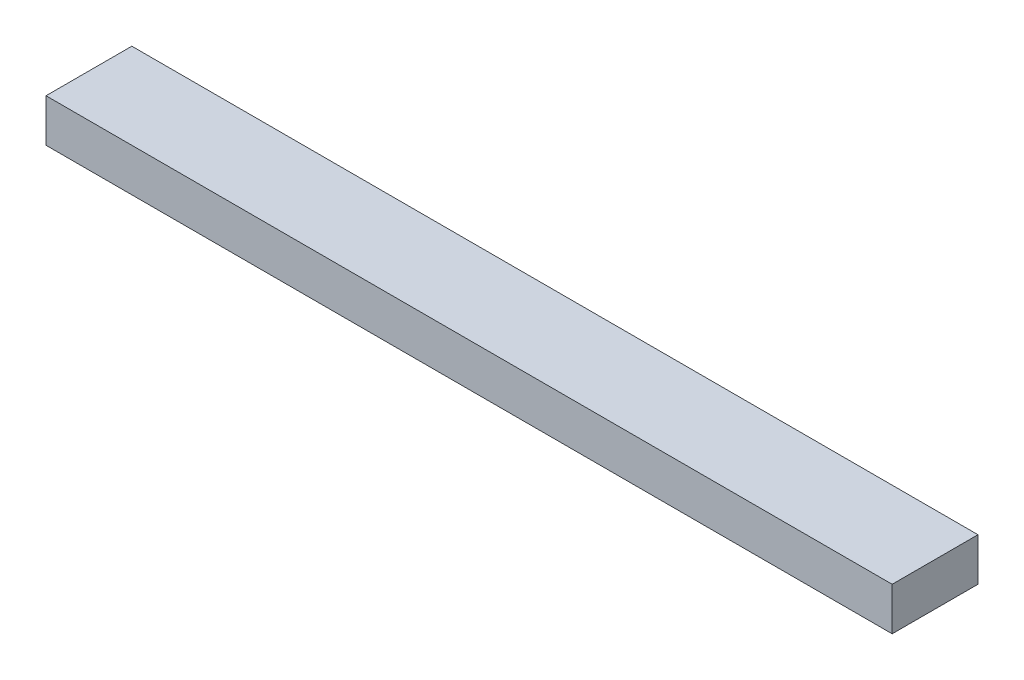
from build123d import *

# Parameters (mm, degrees)
SKETCH1_W           = 50.08
SKETCH1_H           = 5.08
BOSS_EXTRUDE1_DEPTH = 2.54


with BuildPart() as part:
    # Sketch1 → Boss-Extrude1 (new body)
    with BuildSketch(Plane(origin=(0, 0, 0), x_dir=(1, 0, 0), z_dir=(0, 1, 0))):
        Rectangle(SKETCH1_W, SKETCH1_H)
    extrude(amount=BOSS_EXTRUDE1_DEPTH)


solid = part.part
